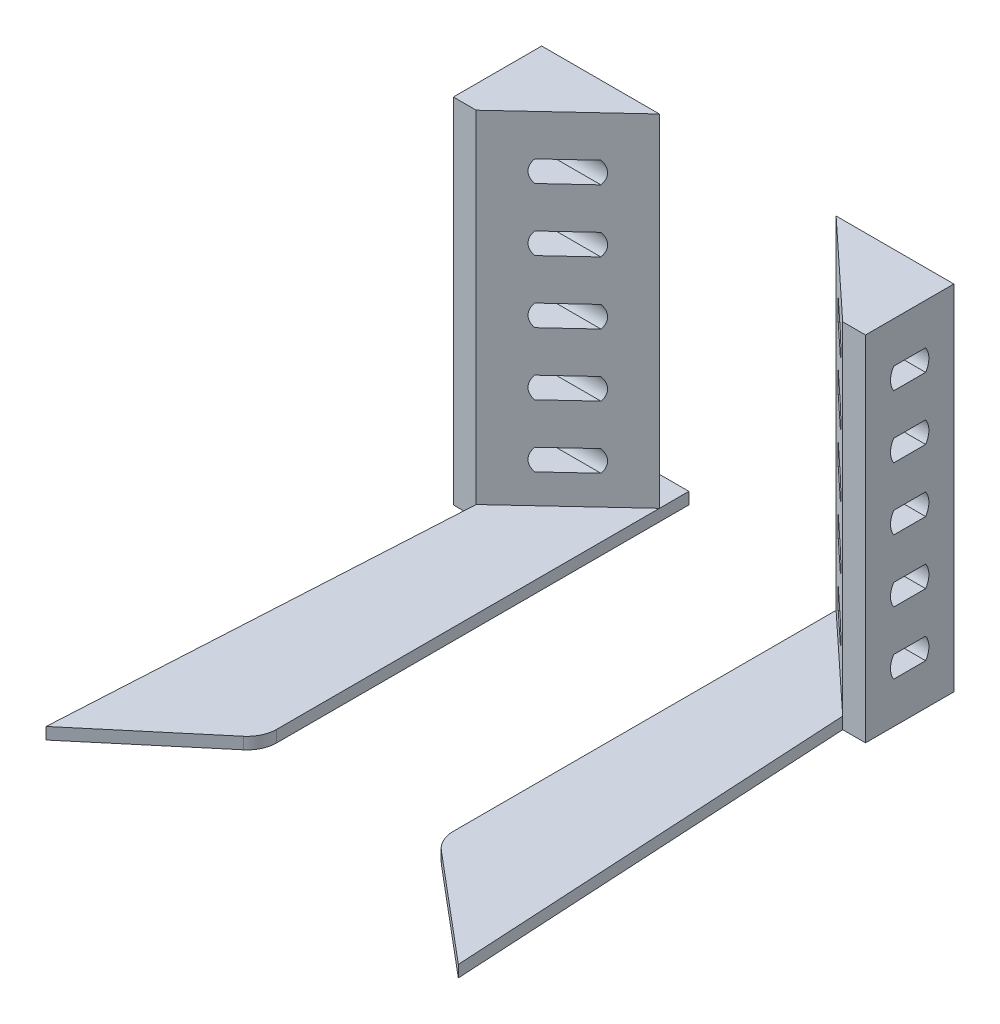
from build123d import *

# Parameters (mm, degrees)
BOSS_EXTRUDE1_DEPTH     = 2
BOSS_EXTRUDE3_DEPTH     = 60
CUT_EXTRUDE1_DEPTH      = 84.263943614
CUT_EXTRUDE1_DEPTH_BACK = 84.263943614
BOSS_EXTRUDE5_DEPTH     = 2
BOSS_EXTRUDE6_DEPTH     = 60
CUT_EXTRUDE2_DEPTH      = 107.9246665
CUT_EXTRUDE2_DEPTH_BACK = 107.9246665


with BuildPart() as part:
    # Sketch1 → Boss-Extrude1 (new body)
    with BuildSketch(Plane(origin=(0, 0, 0), x_dir=(1, 0, 0), z_dir=(0, 1, 0))):
        with BuildLine():
            ThreePointArc((0, -35), (0.467014585, -37.109986547), (1.780817291, -38.825815297))
            Line((1.780817291, -38.825815297), (20, -54.156110515))
            Line((20, -54.156110515), (16.121628113, 15))
            Line((16.121628113, 15), (20, 15))
            Line((20, 15), (20, 30))
            Line((20, 30), (15.280407028, 30))
            Line((15.280407028, 30), (15, 35))
            Line((15, 35), (0, 35))
            Line((0, 35), (0, -35))
        make_face()
    extrude(amount=BOSS_EXTRUDE1_DEPTH)

    # Sketch1<5> → Boss-Extrude3 (add)
    with BuildSketch(Plane(origin=(0, 0, 0), x_dir=(1, 0, 0), z_dir=(0, 1, 0))):
        Polygon((0, 30), (16.121628113, 15), (20, 15), (20, 30), align=None)
    extrude(amount=BOSS_EXTRUDE3_DEPTH)

    # Sketch4 → Cut-Extrude1 (cut, two sides: drawn at the far end of the back side and taken through both)
    with BuildSketch(Plane(origin=(20, 0, 0), x_dir=(0, 0, -1), z_dir=(1, 0, 0)).offset(-CUT_EXTRUDE1_DEPTH_BACK)):
        with BuildLine():
            Line((19.79, 53.016666667), (25.21, 53.016666667))
            ThreePointArc((25.21, 53.016666667), (25.758864833, 51.206666667), (25.21, 49.396666667))
            Line((25.21, 49.396666667), (19.79, 49.396666667))
            ThreePointArc((19.79, 49.396666667), (19.241135167, 51.206666667), (19.79, 53.016666667))
        make_face()
        with BuildLine():
            Line((19.79, 42.413333333), (25.21, 42.413333333))
            ThreePointArc((25.21, 42.413333333), (25.758864833, 40.603333333), (25.21, 38.793333333))
            Line((25.21, 38.793333333), (19.79, 38.793333333))
            ThreePointArc((19.79, 38.793333333), (19.241135167, 40.603333333), (19.79, 42.413333333))
        make_face()
        with BuildLine():
            Line((19.79, 31.81), (25.21, 31.81))
            ThreePointArc((25.21, 31.81), (25.758864833, 30), (25.21, 28.19))
            Line((25.21, 28.19), (19.79, 28.19))
            ThreePointArc((19.79, 28.19), (19.241135167, 30), (19.79, 31.81))
        make_face()
        with BuildLine():
            Line((19.79, 21.206666667), (25.21, 21.206666667))
            ThreePointArc((25.21, 21.206666667), (25.758864833, 19.396666667), (25.21, 17.586666667))
            Line((25.21, 17.586666667), (19.79, 17.586666667))
            ThreePointArc((19.79, 17.586666667), (19.241135167, 19.396666667), (19.79, 21.206666667))
        make_face()
        with BuildLine():
            Line((19.79, 10.603333333), (25.21, 10.603333333))
            ThreePointArc((25.21, 10.603333333), (25.758864833, 8.793333333), (25.21, 6.983333333))
            Line((25.21, 6.983333333), (19.79, 6.983333333))
            ThreePointArc((19.79, 6.983333333), (19.241135167, 8.793333333), (19.79, 10.603333333))
        make_face()
    extrude(amount=CUT_EXTRUDE1_DEPTH + CUT_EXTRUDE1_DEPTH_BACK, mode=Mode.SUBTRACT)


with BuildPart() as body_2:
    # Sketch1<9> → Boss-Extrude5 (new body)
    with BuildSketch(Plane(origin=(0, 0, 0), x_dir=(1, 0, 0), z_dir=(0, 1, 0))):
        with BuildLine():
            Line((-50, 15), (-46.121628113, 15))
            Line((-46.121628113, 15), (-50, -54.156110515))
            Line((-50, -54.156110515), (-31.780817291, -38.825815297))
            ThreePointArc((-31.780817291, -38.825815297), (-30.467014585, -37.109986547), (-30, -35))
            Line((-30, -35), (-30, 35))
            Line((-30, 35), (-45, 35))
            Line((-45, 35), (-45.280407028, 30))
            Line((-45.280407028, 30), (-50, 30))
            Line((-50, 30), (-50, 15))
        make_face()
    extrude(amount=BOSS_EXTRUDE5_DEPTH)

    # Sketch1<10> → Boss-Extrude6 (add)
    with BuildSketch(Plane(origin=(0, 0, 0), x_dir=(1, 0, 0), z_dir=(0, 1, 0))):
        Polygon((-30, 30), (-50, 30), (-50, 15), (-46.121628113, 15), align=None)
    extrude(amount=BOSS_EXTRUDE6_DEPTH)

    # Sketch7 → Cut-Extrude2 (cut, two sides: drawn at the far end of the back side and taken through both)
    with BuildSketch(Plane.ZY.offset(50).offset(-CUT_EXTRUDE2_DEPTH_BACK)):
        with BuildLine():
            Line((-25.21, 53.016666667), (-19.79, 53.016666667))
            ThreePointArc((-19.79, 53.016666667), (-19.241135167, 51.206666667), (-19.79, 49.396666667))
            Line((-19.79, 49.396666667), (-25.21, 49.396666667))
            ThreePointArc((-25.21, 49.396666667), (-25.758864833, 51.206666667), (-25.21, 53.016666667))
        make_face()
        with BuildLine():
            Line((-25.21, 42.413333333), (-19.79, 42.413333333))
            ThreePointArc((-19.79, 42.413333333), (-19.241135167, 40.603333333), (-19.79, 38.793333333))
            Line((-19.79, 38.793333333), (-25.21, 38.793333333))
            ThreePointArc((-25.21, 38.793333333), (-25.758864833, 40.603333333), (-25.21, 42.413333333))
        make_face()
        with BuildLine():
            Line((-25.21, 31.81), (-19.79, 31.81))
            ThreePointArc((-19.79, 31.81), (-19.241135167, 30), (-19.79, 28.19))
            Line((-19.79, 28.19), (-25.21, 28.19))
            ThreePointArc((-25.21, 28.19), (-25.758864833, 30), (-25.21, 31.81))
        make_face()
        with BuildLine():
            Line((-25.21, 21.206666667), (-19.79, 21.206666667))
            ThreePointArc((-19.79, 21.206666667), (-19.241135167, 19.396666667), (-19.79, 17.586666667))
            Line((-19.79, 17.586666667), (-25.21, 17.586666667))
            ThreePointArc((-25.21, 17.586666667), (-25.758864833, 19.396666667), (-25.21, 21.206666667))
        make_face()
        with BuildLine():
            Line((-25.21, 10.603333333), (-19.79, 10.603333333))
            ThreePointArc((-19.79, 10.603333333), (-19.241135167, 8.793333333), (-19.79, 6.983333333))
            Line((-19.79, 6.983333333), (-25.21, 6.983333333))
            ThreePointArc((-25.21, 6.983333333), (-25.758864833, 8.793333333), (-25.21, 10.603333333))
        make_face()
    extrude(amount=CUT_EXTRUDE2_DEPTH + CUT_EXTRUDE2_DEPTH_BACK, mode=Mode.SUBTRACT)


solid = Compound([part.part, body_2.part])
